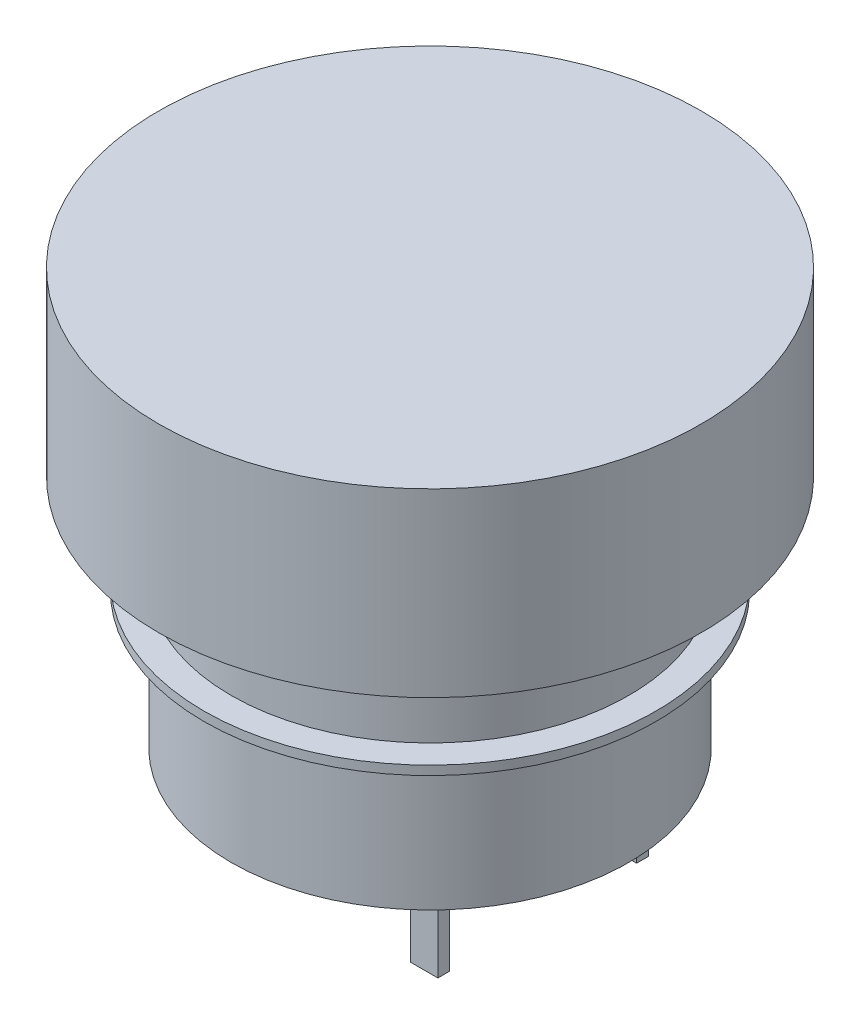
from build123d import *

# Parameters (mm, degrees)
ESQUISSE1_R        = 22
BOSS_EXTRU_1_DEPTH = 15
ESQUISSE2_R        = 25
BOSS_EXTRU_2_DEPTH = 1
ESQUISSE3_R        = 22
BOSS_EXTRU_3_DEPTH = 10
ESQUISSE4_R        = 30
BOSS_EXTRU_4_DEPTH = 20
ESQUISSE5_W        = 3
ESQUISSE5_H        = 1.260124144
ESQUISSE5_H_2      = 1.295969654
BOSS_EXTRU_5_DEPTH = 10


with BuildPart() as part:
    # Esquisse1 → Boss.-Extru.1 (new body)
    with BuildSketch(Plane(origin=(0, 0, 0), x_dir=(1, 0, 0), z_dir=(0, 1, 0))):
        with Locations(Location((0, 0, 0), (0, 0, 270))):
            Circle(ESQUISSE1_R)
    extrude(amount=BOSS_EXTRU_1_DEPTH)

    # Esquisse2 → Boss.-Extru.2 (add)
    with BuildSketch(Plane(origin=(0, 15, 0), x_dir=(1, 0, 0), z_dir=(0, 1, 0))):
        with Locations(Location((0, 0, 0), (0, 0, 270))):
            Circle(ESQUISSE2_R)
    extrude(amount=BOSS_EXTRU_2_DEPTH)

    # Esquisse3 → Boss.-Extru.3 (add)
    with BuildSketch(Plane(origin=(0, 16, 0), x_dir=(1, 0, 0), z_dir=(0, 1, 0))):
        with Locations(Location((0, 0, 0), (0, 0, 270))):
            Circle(ESQUISSE3_R)
    extrude(amount=BOSS_EXTRU_3_DEPTH)

    # Esquisse4 → Boss.-Extru.4 (add)
    with BuildSketch(Plane(origin=(0, 26, 0), x_dir=(1, 0, 0), z_dir=(0, 1, 0))):
        with Locations(Location((0, 0, 0), (0, 0, 270))):
            Circle(ESQUISSE4_R)
    extrude(amount=BOSS_EXTRU_4_DEPTH)

    # Esquisse5 → Boss.-Extru.5 (add)
    with BuildSketch(Plane.XZ):
        with Locations((-11, 11)):
            Rectangle(ESQUISSE5_W, ESQUISSE5_H)
        with Locations((-11, -11)):
            Rectangle(ESQUISSE5_W, ESQUISSE5_H_2)
        with Locations((11, -11)):
            Rectangle(ESQUISSE5_W, ESQUISSE5_H_2)
        with Locations((11, 11)):
            Rectangle(ESQUISSE5_W, ESQUISSE5_H)
    extrude(amount=BOSS_EXTRU_5_DEPTH)


solid = part.part
